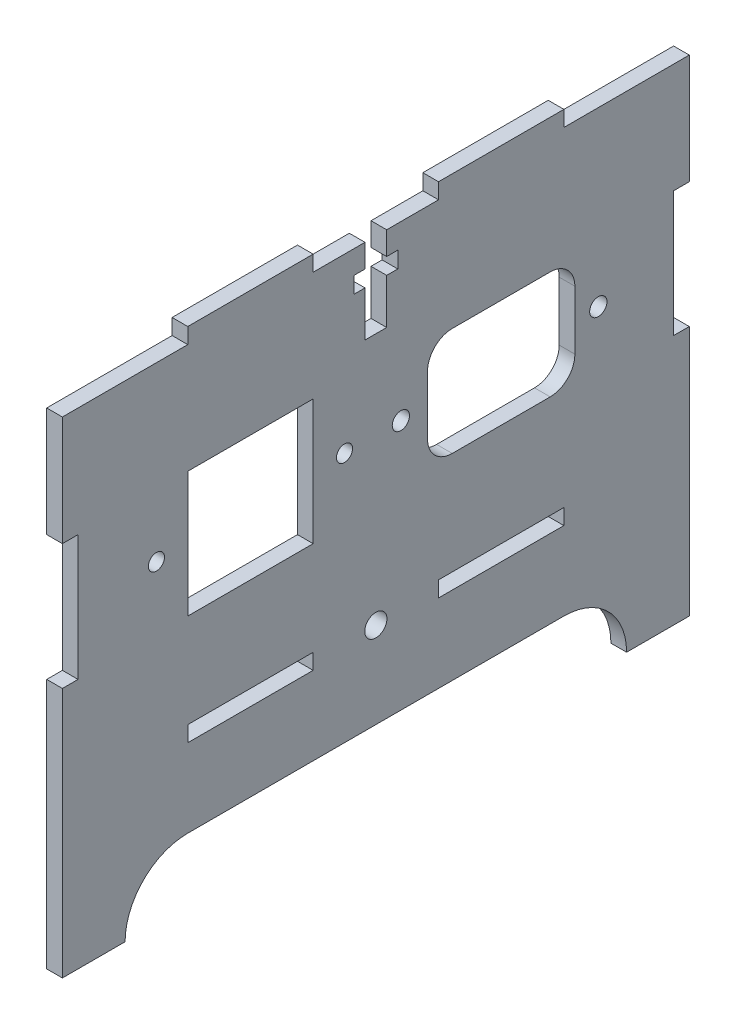
from build123d import *

# Parameters (mm, degrees)
SKETCH1_W                 = 127
SKETCH1_H                 = 101.6
BOSS_EXTRUDE1_DEPTH       = 3.175
SKETCH2_W                 = 25.4
SKETCH2_H                 = 3.175
CUT_EXTRUDE1_DEPTH        = 6.35
LPATTERN1_COUNT           = 3
LPATTERN1_PITCH           = 50.8
CUT_EXTRUDE4_DEPTH        = 6.35
SKETCH8_W                 = 3.175
SKETCH8_H                 = 25.4
CUT_EXTRUDE6_DEPTH        = 6.35
SKETCH9_W                 = 25.4
SKETCH9_H                 = 3.175
CUT_EXTRUDE7_DEPTH        = 6.35
LPATTERN6_COUNT           = 2
LPATTERN6_PITCH           = 50.8
SKETCH16_W                = 4.3942
SKETCH16_H                = 17.145
SKETCH16_W_2              = 8.89
SKETCH16_H_2              = 3.302
CUT_EXTRUDE14_DEPTH       = 6.35
F_8_CLEARANCE_HOLE1_D     = 4.4958
F_8_CLEARANCE_HOLE1_DEPTH = 10.16
F_8_CLEARANCE_HOLE1_TIP   = 1.350674586
SKETCH20_R                = 1.75
CUT_EXTRUDE16_DEPTH       = 7.62
SKETCH25_W                = 25.4
SKETCH25_H                = 25.4
CUT_EXTRUDE20_DEPTH       = 7.62
F_4_CLEARANCE_HOLE1_D     = 3.2639
F_4_CLEARANCE_HOLE1_DEPTH = 10.16
F_4_CLEARANCE_HOLE1_TIP   = 0.980574487


with BuildPart() as part:
    # Sketch1 → Boss-Extrude1 (new body)
    with BuildSketch(Plane(origin=(0, 0, 0), x_dir=(0, 0, -1), z_dir=(1, 0, 0))):
        Rectangle(SKETCH1_W, SKETCH1_H)
    extrude(amount=BOSS_EXTRUDE1_DEPTH)

    # Sketch2 → Cut-Extrude1 (cut)
    with BuildSketch(Plane(origin=(3.175, 0, 0), x_dir=(0, 0, -1), z_dir=(1, 0, 0))):
        with Locations((-50.8, 49.2125)):
            Rectangle(SKETCH2_W, SKETCH2_H)
    cut_extrude1 = extrude(amount=-CUT_EXTRUDE1_DEPTH, mode=Mode.SUBTRACT)

    # LPattern1: Cut-Extrude1 ×3
    with Locations(*[(0, 0, -i * LPATTERN1_PITCH) for i in range(1, LPATTERN1_COUNT)]):
        add(cut_extrude1, mode=Mode.SUBTRACT)

    # Sketch5 → Cut-Extrude4 (cut)
    with BuildSketch(Plane(origin=(3.175, 0, 0), x_dir=(0, 0, -1), z_dir=(1, 0, 0))):
        with BuildLine():
            Line((-38.1, -38.1), (38.1, -38.1))
            ThreePointArc((38.1, -38.1), (50.8, -50.8), (38.1, -63.5))
            Line((38.1, -63.5), (-38.1, -63.5))
            ThreePointArc((-38.1, -63.5), (-50.8, -50.8), (-38.1, -38.1))
        make_face()
    extrude(amount=-CUT_EXTRUDE4_DEPTH, mode=Mode.SUBTRACT)

    # Sketch8 → Cut-Extrude6 (cut)
    with BuildSketch(Plane(origin=(3.175, 0, 0), x_dir=(0, 0, -1), z_dir=(1, 0, 0))):
        with Locations((61.9125, 12.7)):
            Rectangle(SKETCH8_W, SKETCH8_H)
    cut_extrude6 = extrude(amount=-CUT_EXTRUDE6_DEPTH, mode=Mode.SUBTRACT)

    # Sketch9 → Cut-Extrude7 (cut)
    with BuildSketch(Plane.ZY):
        with Locations((-25.4, -20.6375)):
            Rectangle(SKETCH9_W, SKETCH9_H)
    cut_extrude7 = extrude(amount=-CUT_EXTRUDE7_DEPTH, mode=Mode.SUBTRACT)

    # LPattern6: Cut-Extrude7 ×2
    with Locations(*[(0, 0, i * LPATTERN6_PITCH) for i in range(1, LPATTERN6_COUNT)]):
        add(cut_extrude7, mode=Mode.SUBTRACT)

    # Sketch16 → Cut-Extrude14 (cut)
    with BuildSketch(Plane.ZY):
        with Locations((0, 39.0525)):
            Rectangle(SKETCH16_W, SKETCH16_H)
        with Locations((0, 41.275)):
            Rectangle(SKETCH16_W_2, SKETCH16_H_2)
    extrude(amount=-CUT_EXTRUDE14_DEPTH, mode=Mode.SUBTRACT)

    # #8 Clearance Hole1
    with Locations(Plane.ZY):
        with Locations((0, -20.6375)):
            Hole(F_8_CLEARANCE_HOLE1_D / 2, depth=F_8_CLEARANCE_HOLE1_DEPTH)
            with Locations((0, 0, -(F_8_CLEARANCE_HOLE1_DEPTH + F_8_CLEARANCE_HOLE1_TIP / 2))):  # 118° drill point
                Cone(0, F_8_CLEARANCE_HOLE1_D / 2, F_8_CLEARANCE_HOLE1_TIP, mode=Mode.SUBTRACT)

    # Sketch20 → Cut-Extrude16 (cut)
    with BuildSketch(Plane.ZY):
        with Locations((-45.0725, 12.7)):
            Circle(SKETCH20_R)
        with Locations((-5.0725, 12.7)):
            Circle(SKETCH20_R)
        with BuildLine():
            Line((-35.3225, 23.6601), (-15.4775, 23.6601))
            ThreePointArc((-15.4775, 23.6601), (-11.941966094, 22.195633906), (-10.4775, 18.6601))
            Line((-10.4775, 18.6601), (-10.4775, 6.7399))
            ThreePointArc((-10.4775, 6.7399), (-11.941966094, 3.204366094), (-15.4775, 1.7399))
            Line((-15.4775, 1.7399), (-35.3225, 1.7399))
            ThreePointArc((-35.3225, 1.7399), (-38.858033906, 3.204366094), (-40.3225, 6.7399))
            Line((-40.3225, 6.7399), (-40.3225, 18.6601))
            ThreePointArc((-40.3225, 18.6601), (-38.858033906, 22.195633906), (-35.3225, 23.6601))
        make_face()
    extrude(amount=-CUT_EXTRUDE16_DEPTH, mode=Mode.SUBTRACT)

    # Sketch25 → Cut-Extrude20 (cut)
    with BuildSketch(Plane.ZY):
        with Locations((25.4, 12.7)):
            Rectangle(SKETCH25_W, SKETCH25_H)
    extrude(amount=-CUT_EXTRUDE20_DEPTH, mode=Mode.SUBTRACT)

    # Mirror3: Cut-Extrude6 across plane
    add(cut_extrude6.mirror(Plane.XY), mode=Mode.SUBTRACT)

    # #4 Clearance Hole1
    with Locations(Plane(origin=(3.175, 0, 0), x_dir=(0, 0, -1), z_dir=(1, 0, 0))):
        with Locations((-44.45, 12.7), (-6.35, 12.7)):
            Hole(F_4_CLEARANCE_HOLE1_D / 2, depth=F_4_CLEARANCE_HOLE1_DEPTH)
            with Locations((0, 0, -(F_4_CLEARANCE_HOLE1_DEPTH + F_4_CLEARANCE_HOLE1_TIP / 2))):  # 118° drill point
                Cone(0, F_4_CLEARANCE_HOLE1_D / 2, F_4_CLEARANCE_HOLE1_TIP, mode=Mode.SUBTRACT)


solid = part.part
